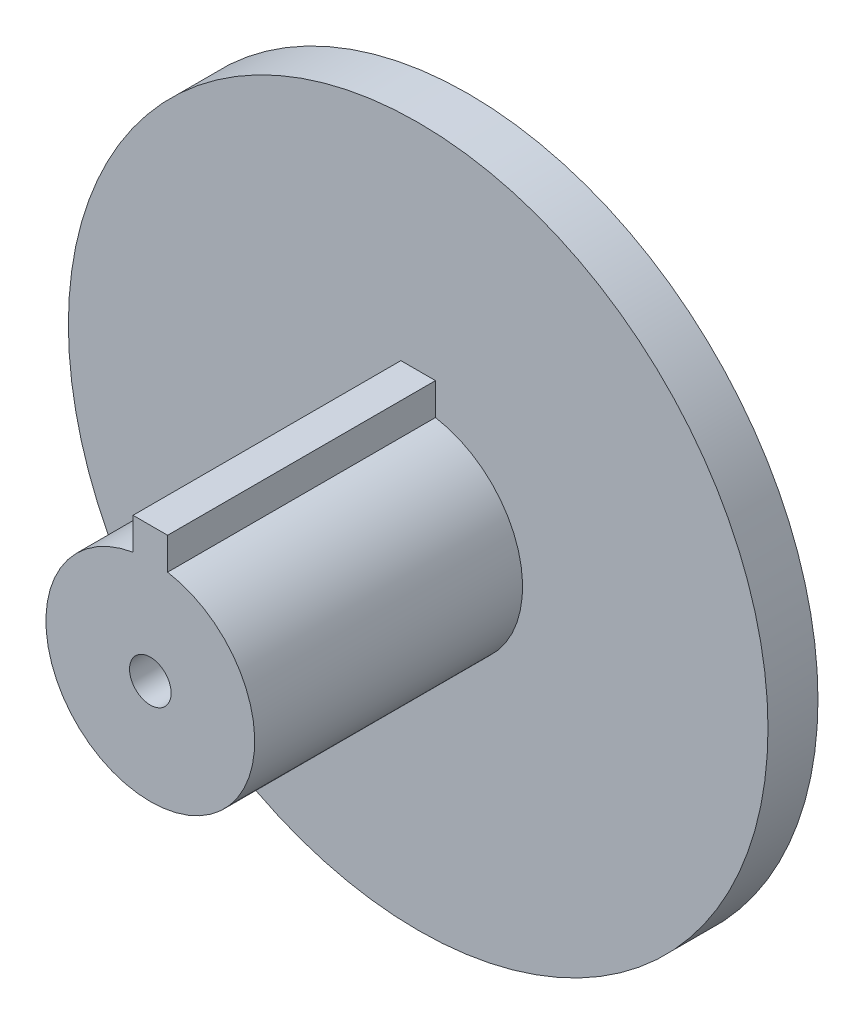
from build123d import *

# Parameters (mm, degrees)
SKETCH1_R           = 44.45
BOSS_EXTRUDE1_DEPTH = 6.35
BOSS_EXTRUDE4_DEPTH = 34.036
SKETCH3_R           = 2.6416
CUT_EXTRUDE1_DEPTH  = 75.717026145


with BuildPart() as part:
    # Sketch1 → Boss-Extrude1 (new body)
    with BuildSketch(Plane.XY):
        Circle(SKETCH1_R)
    extrude(amount=BOSS_EXTRUDE1_DEPTH)

    # Sketch2 → Boss-Extrude4 (add)
    with BuildSketch(Plane.XY.offset(6.35)):
        with BuildLine():
            Line((-2.1971, 17.145), (2.1971, 17.145))
            Line((2.1971, 17.145), (2.1971, 13.081))
            ThreePointArc((2.1971, 13.081), (0, -13.264230449), (-2.1971, 13.081))
            Line((-2.1971, 13.081), (-2.1971, 17.145))
        make_face()
    extrude(amount=BOSS_EXTRUDE4_DEPTH)

    # Sketch3 → Cut-Extrude1 (cut, through all)
    with BuildSketch(Plane(origin=(0, 0, 0), x_dir=(-1, 0, 0), z_dir=(0, 0, -1))):
        Circle(SKETCH3_R)
    extrude(amount=-CUT_EXTRUDE1_DEPTH, mode=Mode.SUBTRACT)


solid = part.part
